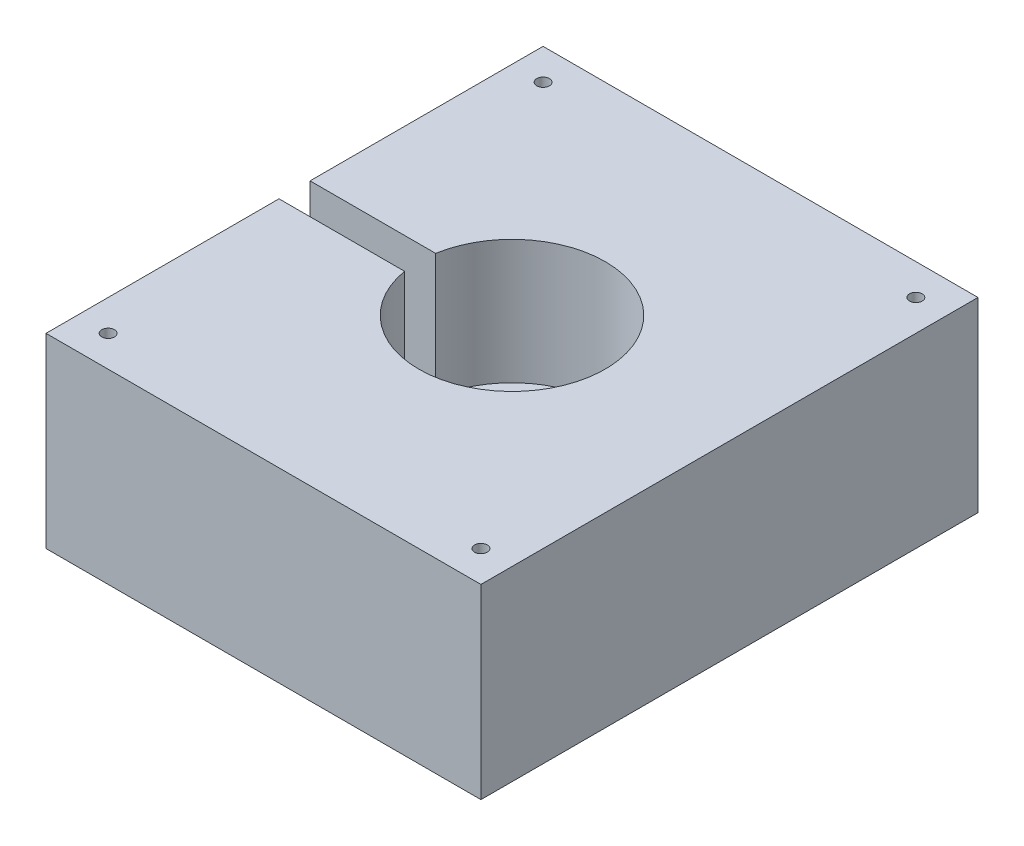
from build123d import *

# Parameters (mm, degrees)
SKETCH1_W                      = 177.8
SKETCH1_H                      = 203.2
BOSS_EXTRUDE1_DEPTH            = 76.2
F_6_0_204_DIAMETER_HOLE1_D     = 5.1816
F_6_0_204_DIAMETER_HOLE1_DEPTH = 11.938
F_6_0_204_DIAMETER_HOLE1_TIP   = 1.556709692
CUT_EXTRUDE1_START             = -50.8
CUT_EXTRUDE1_DEPTH             = 50.8


with BuildPart() as part:
    # Sketch1 → Boss-Extrude1 (new body)
    with BuildSketch(Plane(origin=(0, 0, 0), x_dir=(1, 0, 0), z_dir=(0, 1, 0))):
        Rectangle(SKETCH1_W, SKETCH1_H)
    extrude(amount=BOSS_EXTRUDE1_DEPTH)

    # #6 (0.204) Diameter Hole1
    with Locations(Plane(origin=(0, 76.2, 0), x_dir=(1, 0, 0), z_dir=(0, 1, 0))):
        with Locations((76.2, 88.9), (76.2, -88.9), (-76.2, -88.9), (-76.2, 88.9)):
            Hole(F_6_0_204_DIAMETER_HOLE1_D / 2, depth=F_6_0_204_DIAMETER_HOLE1_DEPTH)
            with Locations((0, 0, -(F_6_0_204_DIAMETER_HOLE1_DEPTH + F_6_0_204_DIAMETER_HOLE1_TIP / 2))):  # 118° drill point
                Cone(0, F_6_0_204_DIAMETER_HOLE1_D / 2, F_6_0_204_DIAMETER_HOLE1_TIP, mode=Mode.SUBTRACT)

    # Sketch4 → Cut-Extrude1 (cut)
    with BuildSketch(Plane(origin=(0, 76.2, 0), x_dir=(1, 0, 0), z_dir=(0, 1, 0)).offset(CUT_EXTRUDE1_START)):
        with BuildLine():
            ThreePointArc((-37.567106623, -6.35), (38.1, 0), (-37.567106623, 6.35))
            Line((-37.567106623, 6.35), (-88.9, 6.35))
            Line((-88.9, 6.35), (-88.9, -6.35))
            Line((-88.9, -6.35), (-37.567106623, -6.35))
        make_face()
    extrude(amount=CUT_EXTRUDE1_DEPTH, mode=Mode.SUBTRACT)


solid = part.part
